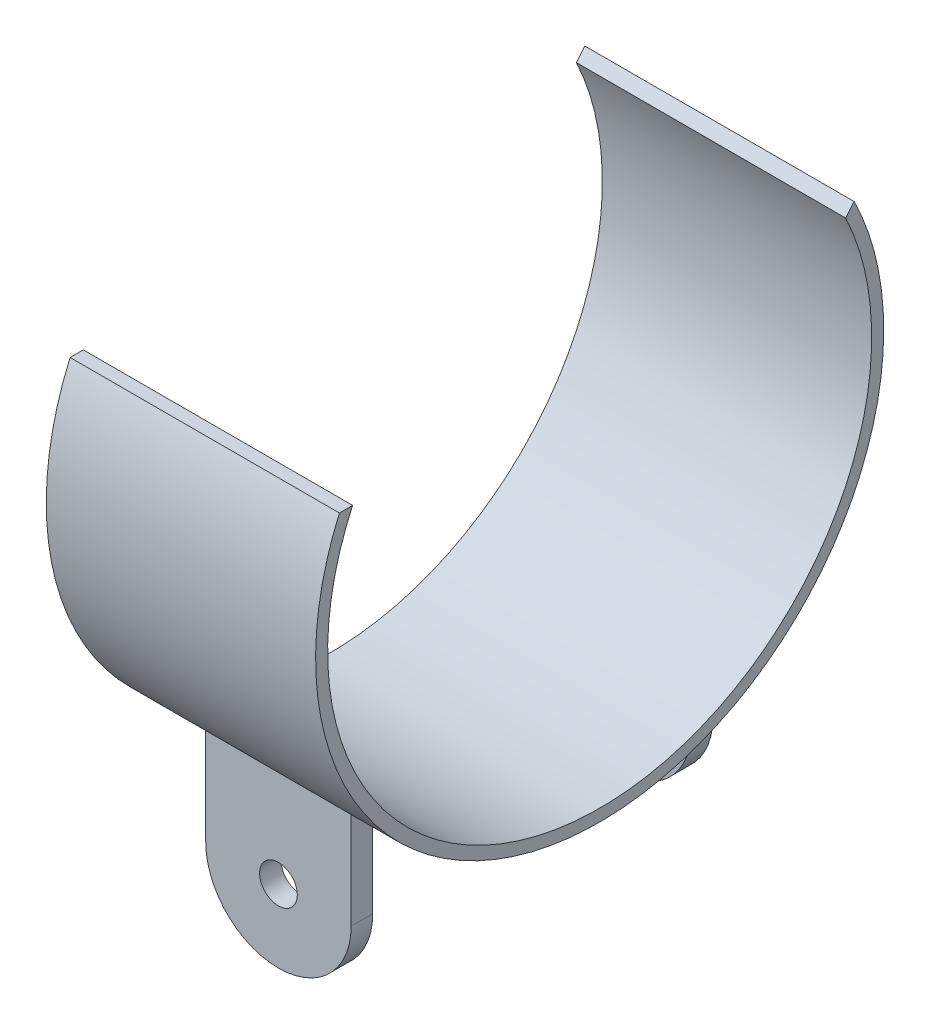
from build123d import *

# Parameters (mm, degrees)
BOSS_EXTRUDE1_DEPTH     = 10
SKETCH2_R               = 17.5
CUT_EXTRUDE1_DEPTH      = 569.981596971
CUT_EXTRUDE2_DEPTH      = 562.341005262
CUT_EXTRUDE2_DEPTH_BACK = 562.341005262
SKETCH3_R               = 252.5


with BuildPart() as part:
    # Sweep1: sweep along a curve in space
    with BuildLine() as sweep1_path:
        ThreePointArc((0, 120.083798472, 63.431105038), (0, -235.570766963, -163.145841721), (0, 120.083798472, -389.72278848))
    # 3DSketch2 → Sweep1 (sweep)
    with BuildSketch(Plane(origin=(125, 120.083798472, 78.431105038), x_dir=(-0.9928768384869221, 0, -0.11914522061843064), z_dir=(0, -1, 0))):
        Polygon((0, 0), (3.574356619, 29.786305155), (251.79356624, 0), (248.219209622, -29.786305155), align=None)
    sweep(path=sweep1_path.line)

    # Sketch1 → Boss-Extrude1 (add, symmetric)
    with BuildSketch(Plane.XY):
        with BuildLine():
            Line((-67.5, -275), (-67.5, -175))
            Line((-67.5, -175), (67.5, -175))
            Line((67.5, -175), (67.5, -275))
            ThreePointArc((67.5, -275), (0, -342.5), (-67.5, -275))
        make_face()
    boss_extrude1 = extrude(amount=BOSS_EXTRUDE1_DEPTH, both=True)

    # Sketch2 → Cut-Extrude1 (cut, through all)
    with BuildSketch(Plane.XY.offset(10)):
        with Locations((0, -275)):
            Circle(SKETCH2_R)
    cut_extrude1 = extrude(amount=-CUT_EXTRUDE1_DEPTH, mode=Mode.SUBTRACT)

    # Mirror1: Boss-Extrude1, Cut-Extrude1 across plane
    add(boss_extrude1.mirror(Plane(origin=(0, 0, -157.91266462), x_dir=(1, 0, 0), z_dir=(0, 0, -1))))
    add(cut_extrude1.mirror(Plane(origin=(0, 0, -157.91266462), x_dir=(1, 0, 0), z_dir=(0, 0, -1))), mode=Mode.SUBTRACT)

    # Sketch3 → Cut-Extrude2 (cut, two sides: drawn at the far end of the back side and taken through both)
    with BuildSketch(Plane(origin=(0, 0, 0), x_dir=(0, 0, -1), z_dir=(1, 0, 0)).offset(-CUT_EXTRUDE2_DEPTH_BACK)):
        with Locations((163.145841721, 14.429233037)):
            Circle(SKETCH3_R)
    extrude(amount=CUT_EXTRUDE2_DEPTH + CUT_EXTRUDE2_DEPTH_BACK, mode=Mode.SUBTRACT)


solid = part.part
